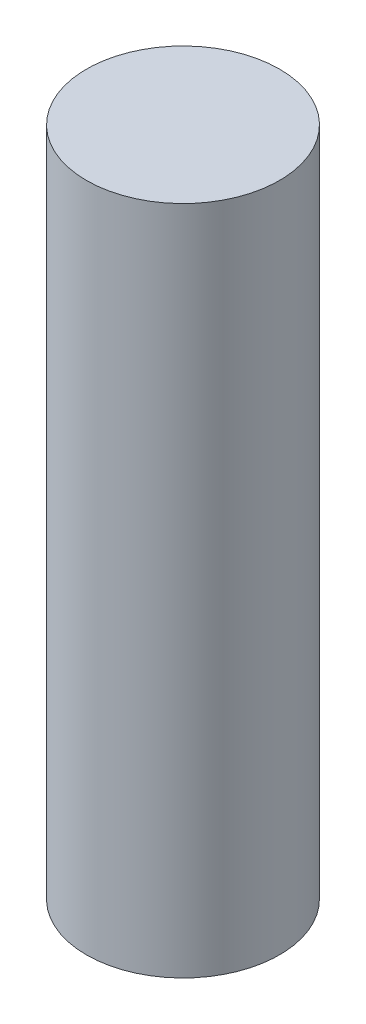
from build123d import *

# Parameters (mm, degrees)
SKETCH1_R           = 2.95
BOSS_EXTRUDE1_DEPTH = 20.5


with BuildPart() as part:
    # Sketch1 → Boss-Extrude1 (new body)
    with BuildSketch(Plane(origin=(0, 0, 0), x_dir=(1, 0, 0), z_dir=(0, 1, 0))):
        with Locations(Location((0, 0, 0), (0, 0, 270))):
            Circle(SKETCH1_R)
    extrude(amount=BOSS_EXTRUDE1_DEPTH)


solid = part.part
